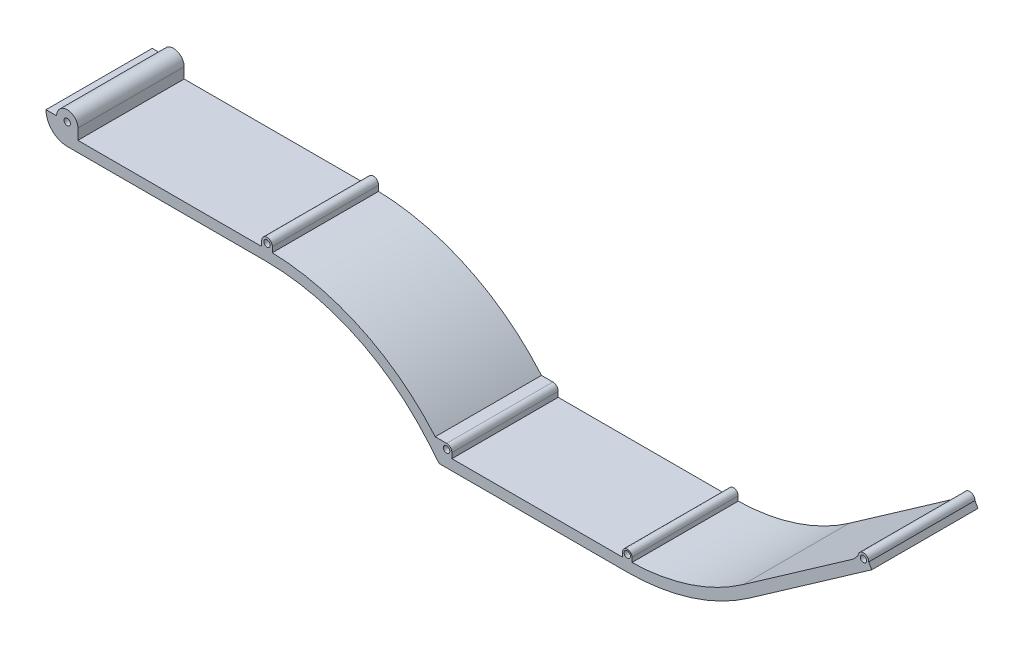
from build123d import *

# Parameters (mm, degrees)
SKETCH1_R           = 1.5
BOSS_EXTRUDE1_DEPTH = 50
SKETCH3_R           = 1.5
CUT_EXTRUDE1_DEPTH  = 50


with BuildPart() as part:
    # Sketch1 → Boss-Extrude1 (new body)
    with BuildSketch(Plane.XY):
        with BuildLine():
            ThreePointArc((-438.463421682, 243.552927072), (-440.963421682, 246.052927072), (-443.463421682, 243.552927072))
            Line((-443.463421682, 243.552927072), (-443.463421682, 241.075715503))
            Line((-443.463421682, 241.075715503), (-443.553411549, 241.076505927))
            Line((-443.553411549, 241.076505927), (-529.959210098, 241.076505927))
            Line((-529.959210098, 241.076505927), (-529.959210098, 246.076505927))
            ThreePointArc((-529.959210098, 246.076505927), (-534.959210098, 251.076505927), (-539.959210098, 246.076505927))
            Line((-539.959210098, 246.076505927), (-544.959210098, 246.076505927))
            ThreePointArc((-544.959210098, 246.076505927), (-542.030277909, 239.005438115), (-534.959210098, 236.076505927))
            Line((-534.959210098, 236.076505927), (-441.589975913, 236.076505927))
            ThreePointArc((-441.589975913, 236.076505927), (-399.328149739, 226.70728463), (-364.985531601, 200.355266895))
            Line((-364.985531601, 200.355266895), (-359.959210098, 194.365130186))
            Line((-359.959210098, 194.365130186), (-271.489088985, 194.365130186))
            ThreePointArc((-271.489088985, 194.365130186), (-241.418509035, 198.993435111), (-214.13144535, 212.449925757))
            Line((-214.13144535, 212.449925757), (-156.452183895, 252.837379426))
            Line((-156.452183895, 252.837379426), (-157.855222331, 255.337379426))
            ThreePointArc((-157.855222331, 255.337379426), (-160.355222331, 257.837379426), (-162.855222331, 255.337379426))
            Line((-162.855222331, 255.337379426), (-165.169417873, 252.837379426))
            Line((-165.169417873, 252.837379426), (-216.999327532, 216.545685979))
            ThreePointArc((-216.999327532, 216.545685979), (-241.871536557, 204.099961997), (-269.282233437, 199.390766337))
            Line((-269.282233437, 199.390766337), (-269.282233437, 201.571985734))
            ThreePointArc((-269.282233437, 201.571985734), (-271.489088985, 203.778841282), (-273.695944534, 201.571985734))
            Line((-273.695944534, 201.571985734), (-273.695944534, 199.365130186))
            Line((-273.695944534, 199.365130186), (-353.961902661, 199.365130186))
            Line((-353.961902661, 199.365130186), (-353.961902661, 201.865130186))
            ThreePointArc((-353.961902661, 201.865130186), (-354.694135708, 203.632897139), (-356.461902661, 204.365130186))
            Line((-356.461902661, 204.365130186), (-361.829937067, 204.365130186))
            ThreePointArc((-361.829937067, 204.365130186), (-396.313657586, 230.813272806), (-438.553411549, 241.032588537))
            Line((-438.553411549, 241.032588537), (-438.463421682, 241.031798113))
            Line((-438.463421682, 241.031798113), (-438.463421682, 243.552927072))
        make_face()
        with Locations((-440.963421682, 243.552927072)):
            Circle(SKETCH1_R, mode=Mode.SUBTRACT)
        with Locations((-534.959210098, 246.076505927)):
            Circle(SKETCH1_R, mode=Mode.SUBTRACT)
        with Locations((-160.355222331, 255.337379426)):
            Circle(SKETCH1_R, mode=Mode.SUBTRACT)
        with Locations((-356.461902661, 201.865130186)):
            Circle(SKETCH1_R, mode=Mode.SUBTRACT)
    extrude(amount=BOSS_EXTRUDE1_DEPTH)

    # Sketch3 → Cut-Extrude1 (cut)
    with BuildSketch(Plane.XY.offset(50)):
        with Locations((-271.489088985, 201.571985734)):
            Circle(SKETCH3_R)
    extrude(amount=-CUT_EXTRUDE1_DEPTH, mode=Mode.SUBTRACT)


solid = part.part
